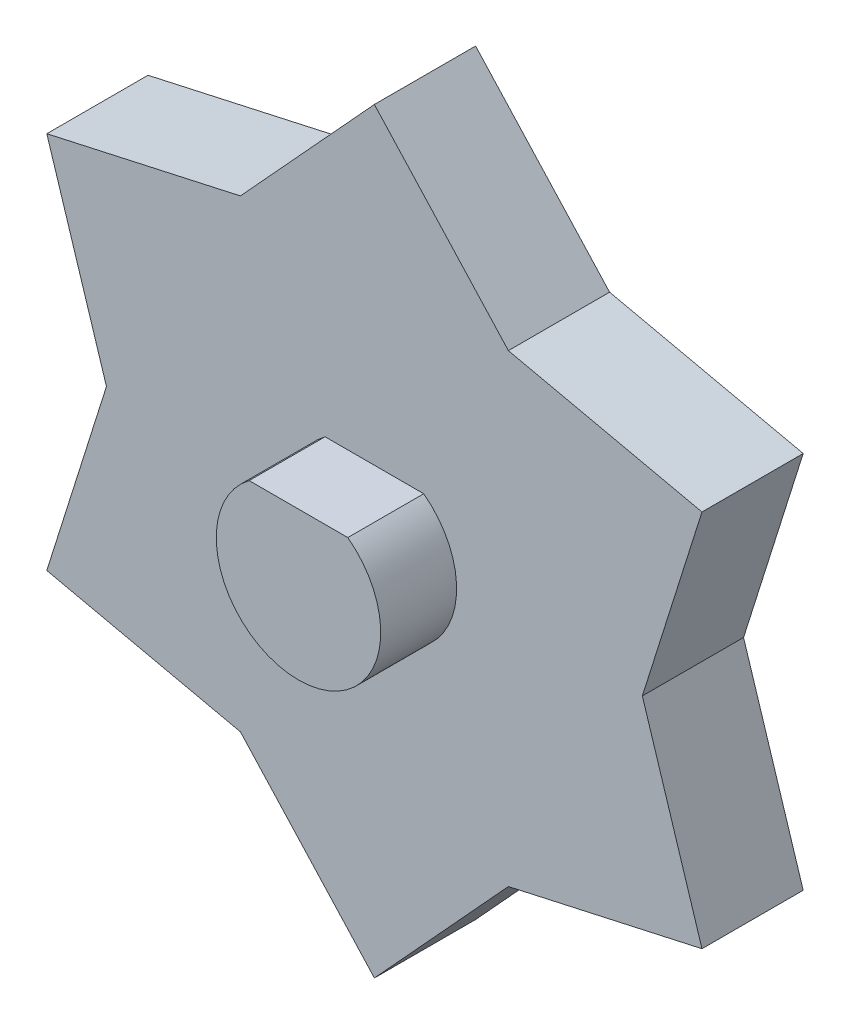
from build123d import *

# Parameters (mm, degrees)
BOSS_EXTRUDE1_DEPTH      = 2
BOSS_EXTRUDE2_DEPTH      = 1.5
BOSS_EXTRUDE2_DEPTH_BACK = 2


with BuildPart() as part:
    # Sketch1 → Boss-Extrude1 (new body)
    with BuildSketch(Plane.XY):
        Polygon((0, -7.474945526), (2.647536041, -4.585666938), (6.473492718, -3.737472763), (5.295072082, 0), (6.473492718, 3.737472763), (2.647536041, 4.585666938), (0, 7.474945526), (-2.647536041, 4.585666938), (-6.473492718, 3.737472763), (-5.295072082, 0), (-6.473492718, -3.737472763), (-2.647536041, -4.585666938), align=None)
    extrude(amount=-BOSS_EXTRUDE1_DEPTH)

    # Sketch1<4> → Boss-Extrude2 (add, two sides: drawn at the far end of the back side and taken through both)
    with BuildSketch(Plane.XY.offset(-BOSS_EXTRUDE2_DEPTH_BACK)):
        with BuildLine():
            Line((0.975, 1.3), (-0.975, 1.3))
            ThreePointArc((-0.975, 1.3), (0, -1.625), (0.975, 1.3))
        make_face()
    extrude(amount=BOSS_EXTRUDE2_DEPTH + BOSS_EXTRUDE2_DEPTH_BACK)


solid = part.part
